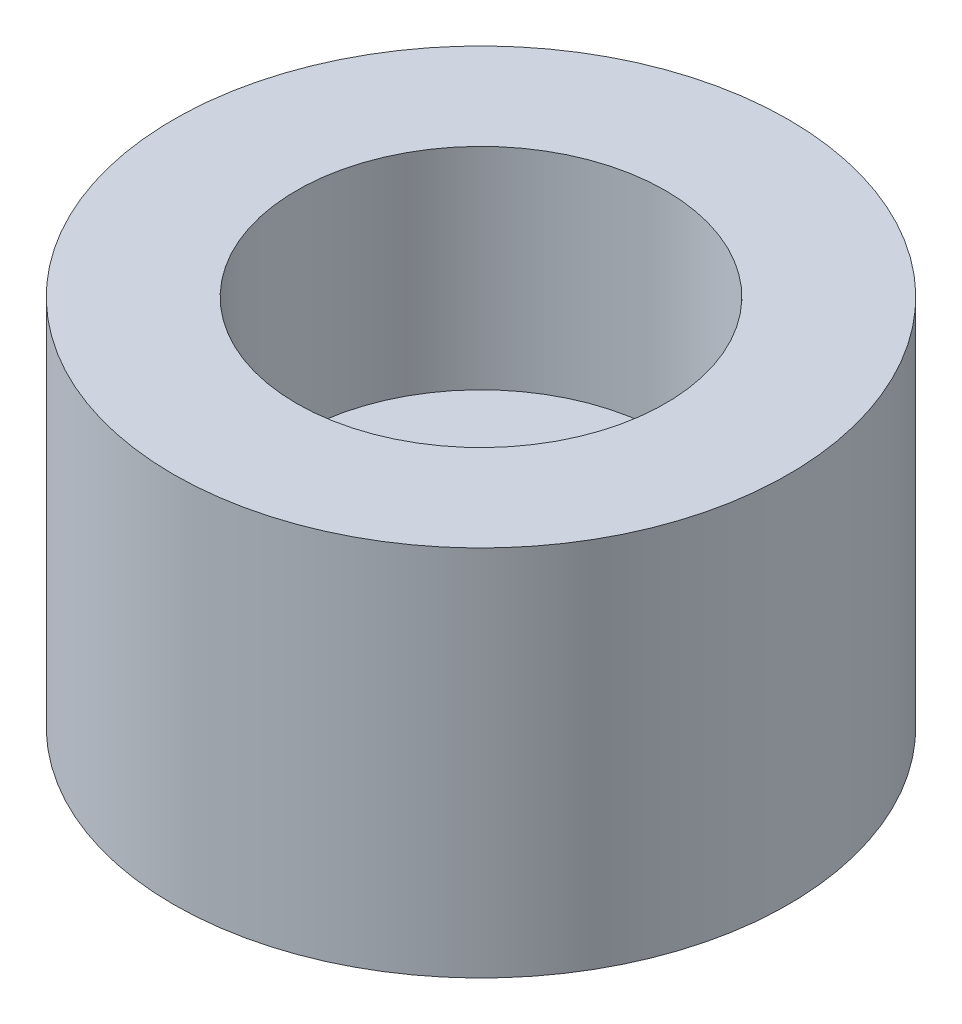
from build123d import *

# Parameters (mm, degrees)
SKETCH1_R           = 4.375
SKETCH1_R_2         = 2.625
BOSS_EXTRUDE1_DEPTH = 3
BOSS_EXTRUDE2_START = 2.3
SKETCH2_R           = 4.375
SKETCH2_R_2         = 1.425
BOSS_EXTRUDE2_DEPTH = 2.3


with BuildPart() as part:
    # Sketch1 → Boss-Extrude1 (new body)
    with BuildSketch(Plane(origin=(0, 0, 0), x_dir=(1, 0, 0), z_dir=(0, 1, 0))):
        with Locations(Location((0, 0, 0), (0, 0, 270))):
            Circle(SKETCH1_R)
        with Locations(Location((0, 0, 0), (0, 0, 270))):
            Circle(SKETCH1_R_2, mode=Mode.SUBTRACT)
    extrude(amount=BOSS_EXTRUDE1_DEPTH)

    # Sketch2 → Boss-Extrude2 (add)
    with BuildSketch(Plane.XZ.offset(BOSS_EXTRUDE2_START)):
        with Locations(Location((0, 0, 0), (0, 0, 270))):
            Circle(SKETCH2_R)
        with Locations(Location((0, 0, 0), (0, 0, 270))):
            Circle(SKETCH2_R_2, mode=Mode.SUBTRACT)
    extrude(amount=-BOSS_EXTRUDE2_DEPTH)


solid = part.part
